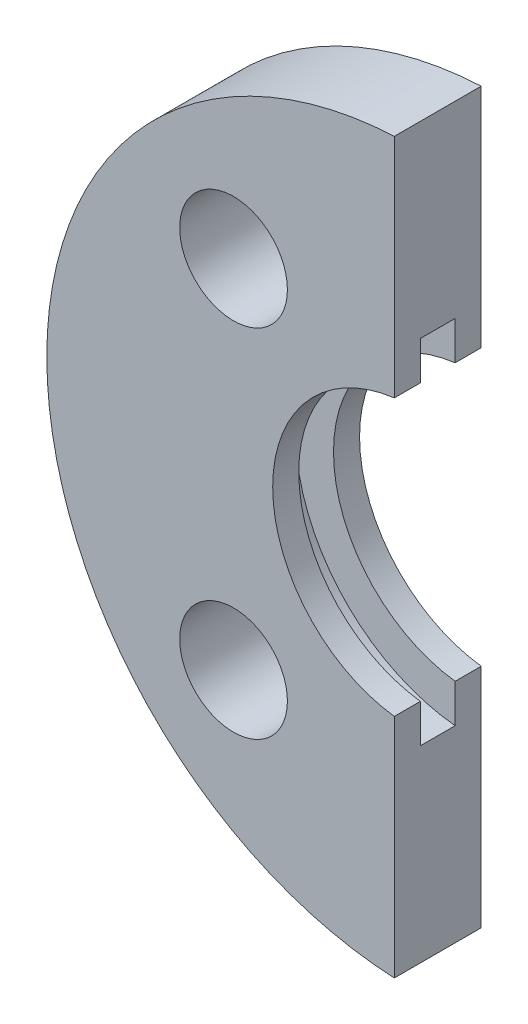
from build123d import *

# Parameters (mm, degrees)
SKETCH_1_R          = 21
SKETCH_1_R_2        = 3.1
SKETCH_1_R_3        = 8
EXTRUDE_1_DEPTH     = 5
CUT_EXTRUDE_1_DEPTH = 10
SKETCH_3_W          = 2
SKETCH_3_H          = 1.455022594
CUT_EXTRUDE_2_DEPTH = 2
SKETCH_4_R          = 10.2
CUT_EXTRUDE_3_DEPTH = 2


with BuildPart() as part:
    # 草图1 → 凸台-拉伸1 (new body)
    with BuildSketch(Plane.XY):
        Circle(SKETCH_1_R)
        with Locations((-10.253048327, 10.253048327)):
            Circle(SKETCH_1_R_2, mode=Mode.SUBTRACT)
        with Locations((10.253048327, 10.253048327)):
            Circle(SKETCH_1_R_2, mode=Mode.SUBTRACT)
        with Locations((-10.253048327, -10.253048327)):
            Circle(SKETCH_1_R_2, mode=Mode.SUBTRACT)
        with Locations((10.253048327, -10.253048327)):
            Circle(SKETCH_1_R_2, mode=Mode.SUBTRACT)
        Circle(SKETCH_1_R_3, mode=Mode.SUBTRACT)
    extrude(amount=EXTRUDE_1_DEPTH)

    # 草图2 → 切除-拉伸1 (cut)
    with BuildSketch(Plane.XY.offset(5)):
        Polygon((-1, 0), (-1, 23.542037427), (27.759132826, 23.542037427), (27.759132826, -27.308763415), (-1, -27.308763415), align=None)
    extrude(amount=-CUT_EXTRUDE_1_DEPTH, mode=Mode.SUBTRACT)

    # 草图3 → 切除-拉伸2 (cut)
    with BuildSketch(Plane(origin=(-1, 0, 0), x_dir=(0, 0, -1), z_dir=(1, 0, 0))):
        with Locations((-2.5, 7.937253933)):
            Rectangle(SKETCH_3_W, SKETCH_3_H)
    extrude(amount=-CUT_EXTRUDE_2_DEPTH, mode=Mode.SUBTRACT)

    # 草图4 → 切除-拉伸3 (cut)
    with BuildSketch(Plane.XY.offset(1.5)):
        Circle(SKETCH_4_R)
    extrude(amount=CUT_EXTRUDE_3_DEPTH, mode=Mode.SUBTRACT)


solid = part.part
